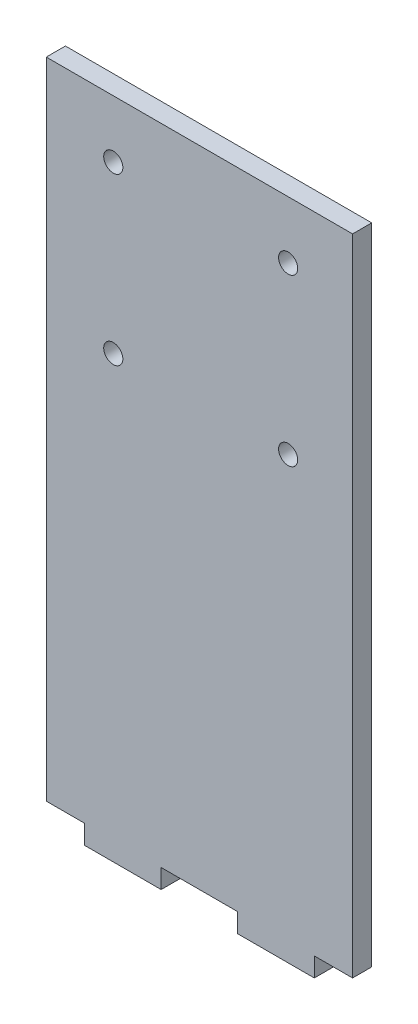
from build123d import *

# Parameters (mm, degrees)
SKETCH1_R           = 1.5875
BOSS_EXTRUDE1_DEPTH = 3.175


with BuildPart() as part:
    # Sketch1 → Boss-Extrude1 (new body)
    with BuildSketch(Plane.XY):
        Polygon((50.8, 106.875), (11.1125, 106.875), (0, 106.875), (0, 0), (6.35, 0), (6.35, -3.175), (19.05, -3.175), (19.05, 0), (31.75, 0), (31.75, -3.175), (44.45, -3.175), (44.45, 0), (50.8, 0), align=None)
        with BuildLine():
            ThreePointArc((11.1125, 68.2625), (9.525, 69.85), (11.1125, 71.4375))
            ThreePointArc((11.1125, 71.4375), (12.235032015, 70.972532015), (12.7, 69.85))
            ThreePointArc((12.7, 69.85), (12.235032015, 68.727467985), (11.1125, 68.2625))
        make_face(mode=Mode.SUBTRACT)
        with BuildLine():
            ThreePointArc((11.1125, 95.7625), (9.525, 97.35), (11.1125, 98.9375))
            ThreePointArc((11.1125, 98.9375), (12.235032015, 98.472532015), (12.7, 97.35))
            ThreePointArc((12.7, 97.35), (12.235032015, 96.227467985), (11.1125, 95.7625))
        make_face(mode=Mode.SUBTRACT)
        with Locations((40.1125, 69.85)):
            Circle(SKETCH1_R, mode=Mode.SUBTRACT)
        with Locations((40.1125, 97.35)):
            Circle(SKETCH1_R, mode=Mode.SUBTRACT)
    extrude(amount=BOSS_EXTRUDE1_DEPTH)


solid = part.part
